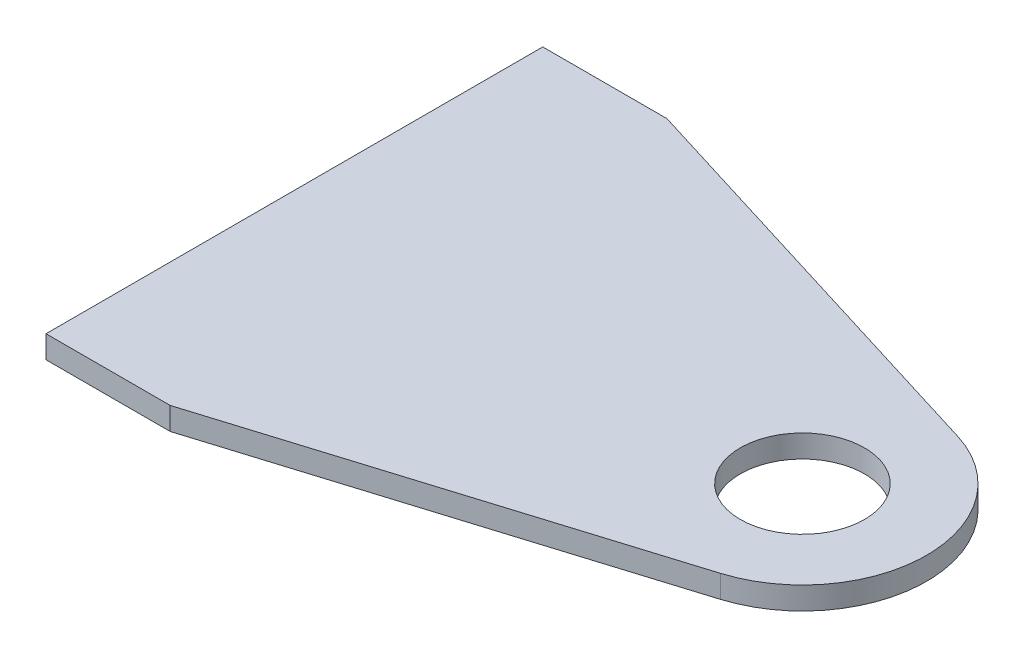
from build123d import *

# Parameters (mm, degrees)
SKETCH_W_DIMENSIONS_R = 27.5
EXTRUDE_10MM_DEPTH    = 10


with BuildPart() as part:
    # sketch_w_dimensions → extrude_10mm (new body)
    with BuildSketch(Plane(origin=(0, 0, 0), x_dir=(1, 0, 0), z_dir=(0, 1, 0))):
        with BuildLine():
            Line((-225, 110), (-225, -110))
            Line((-225, -110), (-170, -110))
            Line((-170, -110), (16.21278302, -52.556119213))
            ThreePointArc((16.21278302, -52.556119213), (55, 0), (16.21278302, 52.556119213))
            Line((16.21278302, 52.556119213), (-170, 110))
            Line((-170, 110), (-225, 110))
        make_face()
        with Locations(Location((0, 0, 0), (0, 0, 270))):
            Circle(SKETCH_W_DIMENSIONS_R, mode=Mode.SUBTRACT)
    extrude(amount=EXTRUDE_10MM_DEPTH)


solid = part.part
